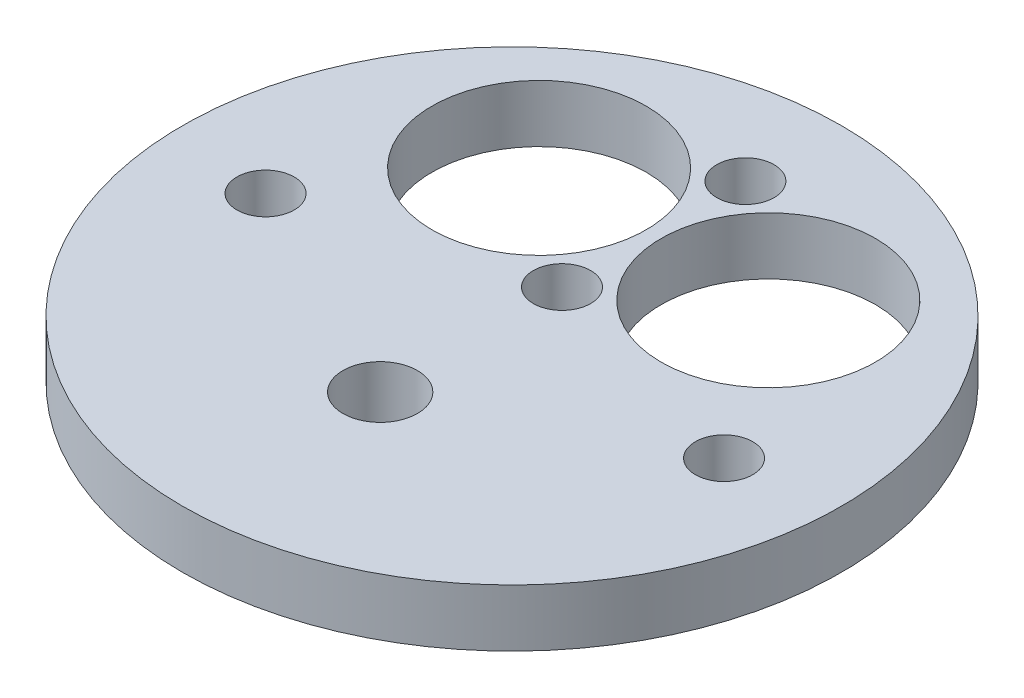
from build123d import *

# Parameters (mm, degrees)
SKETCH1_W               = 36.5125
SKETCH1_H               = 6.35
CUT_EXTRUDE1_DEPTH      = 53.025453506
CUT_EXTRUDE1_DEPTH_BACK = 53.025453506
SKETCH2_R               = 11.8745
SKETCH2_R_2             = 3.175
SKETCH2_R_3             = 4.1275
CUT_EXTRUDE2_DEPTH      = 53.025453506
CUT_EXTRUDE2_DEPTH_BACK = 53.025453506
SKETCH3_R               = 3.175


with BuildPart() as part:
    # Sketch1 → Revolve1 (revolve)
    with BuildSketch(Plane.XY):
        with Locations((18.25625, 3.175)):
            Rectangle(SKETCH1_W, SKETCH1_H)
    revolve(axis=Axis((0, 0, 0), (0, 1, 0)))

    # Sketch2 → Cut-Extrude1 (cut, two sides: drawn at the far end of the back side and taken through both)
    with BuildSketch(Plane(origin=(0, 6.35, 0), x_dir=(1, 0, 0), z_dir=(0, 1, 0)).offset(-CUT_EXTRUDE1_DEPTH_BACK)):
        with Locations((-12.7, 15.699275429)):
            Circle(SKETCH2_R)
        with Locations((12.7, 15.699275429)):
            Circle(SKETCH2_R)
        with Locations((0, 25.859275429)):
            Circle(SKETCH2_R_2)
        with Locations((0, 5.539275429)):
            Circle(SKETCH2_R_2)
        with Locations((0, -14.605)):
            Circle(SKETCH2_R_3)
    extrude(amount=CUT_EXTRUDE1_DEPTH + CUT_EXTRUDE1_DEPTH_BACK, mode=Mode.SUBTRACT)

    # Sketch3 → Cut-Extrude2 (cut, two sides: drawn at the far end of the back side and taken through both)
    with BuildSketch(Plane(origin=(0, 6.35, 0), x_dir=(1, 0, 0), z_dir=(0, 1, 0)).offset(-CUT_EXTRUDE2_DEPTH_BACK)):
        with Locations((-25.4, -1.905)):
            Circle(SKETCH3_R)
        with Locations((25.4, -1.905)):
            Circle(SKETCH3_R)
    extrude(amount=CUT_EXTRUDE2_DEPTH + CUT_EXTRUDE2_DEPTH_BACK, mode=Mode.SUBTRACT)


solid = part.part
